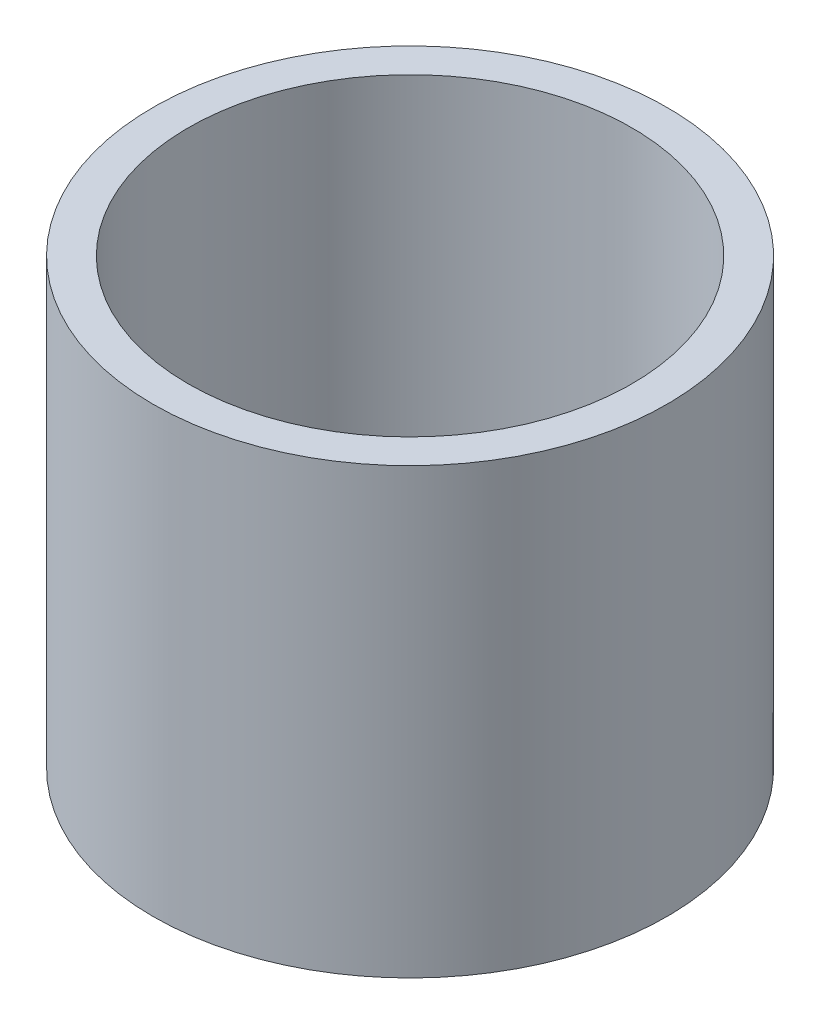
from build123d import *

# Parameters (mm, degrees)
SKETCH1_R           = 23.175
SKETCH1_R_2         = 20
BOSS_EXTRUDE1_DEPTH = 40


with BuildPart() as part:
    # Sketch1 → Boss-Extrude1 (new body)
    with BuildSketch(Plane(origin=(0, 0, 0), x_dir=(1, 0, 0), z_dir=(0, 1, 0))):
        with Locations(Location((0, 0, 0), (0, 0, 270))):
            Circle(SKETCH1_R)
        with Locations(Location((0, 0, 0), (0, 0, 270))):
            Circle(SKETCH1_R_2, mode=Mode.SUBTRACT)
    extrude(amount=BOSS_EXTRUDE1_DEPTH)


solid = part.part
